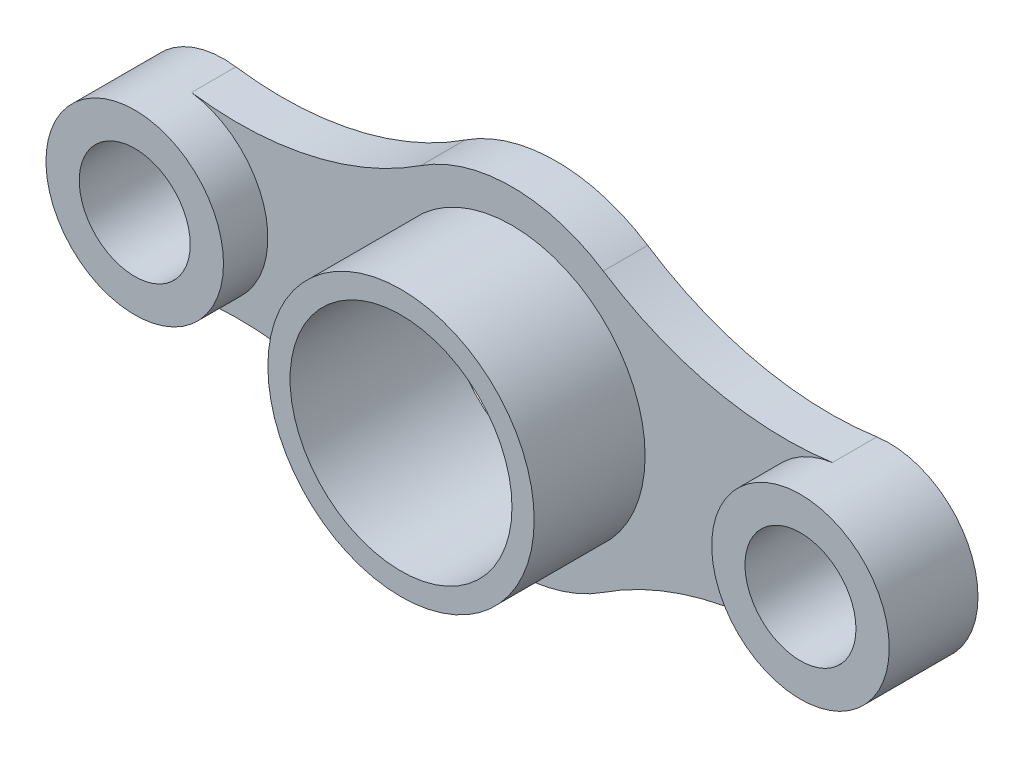
from build123d import *

# Parameters (mm, degrees)
SKETCH1_R           = 60
BOSS_EXTRUDE1_DEPTH = 20
SKETCH1_3_R         = 60
SKETCH1_3_R_2       = 50
BOSS_EXTRUDE2_DEPTH = 70
SKETCH1_5_R         = 40
SKETCH1_5_R_2       = 25
BOSS_EXTRUDE3_DEPTH = 40


with BuildPart() as part:
    # Sketch1 → Boss-Extrude1 (new body)
    with BuildSketch(Plane.XY):
        with BuildLine():
            ThreePointArc((-144.403508772, -39.606556098), (-90.666225841, -41.750102304), (-41.138888889, -62.710380488))
            ThreePointArc((-41.138888889, -62.710380488), (0, -75), (41.138888889, -62.710380488))
            ThreePointArc((41.138888889, -62.710380488), (90.666225841, -41.750102304), (144.403508772, -39.606556098))
            ThreePointArc((144.403508772, -39.606556098), (110, 0), (144.403508772, 39.606556098))
            ThreePointArc((144.403508772, 39.606556098), (90.666225841, 41.750102304), (41.138888889, 62.710380488))
            ThreePointArc((41.138888889, 62.710380488), (0, 75), (-41.138888889, 62.710380488))
            ThreePointArc((-41.138888889, 62.710380488), (-90.666225841, 41.750102304), (-144.403508772, 39.606556098))
            ThreePointArc((-144.403508772, 39.606556098), (-119.801824152, 26.23109177), (-110, 0))
            ThreePointArc((-110, 0), (-119.801824152, -26.23109177), (-144.403508772, -39.606556098))
        make_face()
        Circle(SKETCH1_R, mode=Mode.SUBTRACT)
    extrude(amount=BOSS_EXTRUDE1_DEPTH)

    # Sketch1<3> → Boss-Extrude2 (add)
    with BuildSketch(Plane.XY):
        Circle(SKETCH1_3_R)
        Circle(SKETCH1_3_R_2, mode=Mode.SUBTRACT)
    extrude(amount=BOSS_EXTRUDE2_DEPTH)

    # Sketch1<5> → Boss-Extrude3 (add)
    # profile 1 of 2: a face of its own
    with BuildSketch(Plane.XY):
        with Locations((-150, 0)):
            Circle(SKETCH1_5_R)
        with Locations((-150, 0)):
            Circle(SKETCH1_5_R_2, mode=Mode.SUBTRACT)
    # profile 2 of 2: a face of its own
    with BuildSketch(Plane.XY):
        with Locations((150, 0)):
            Circle(SKETCH1_5_R)
        with Locations((150, 0)):
            Circle(SKETCH1_5_R_2, mode=Mode.SUBTRACT)
    extrude(amount=BOSS_EXTRUDE3_DEPTH)


solid = part.part
